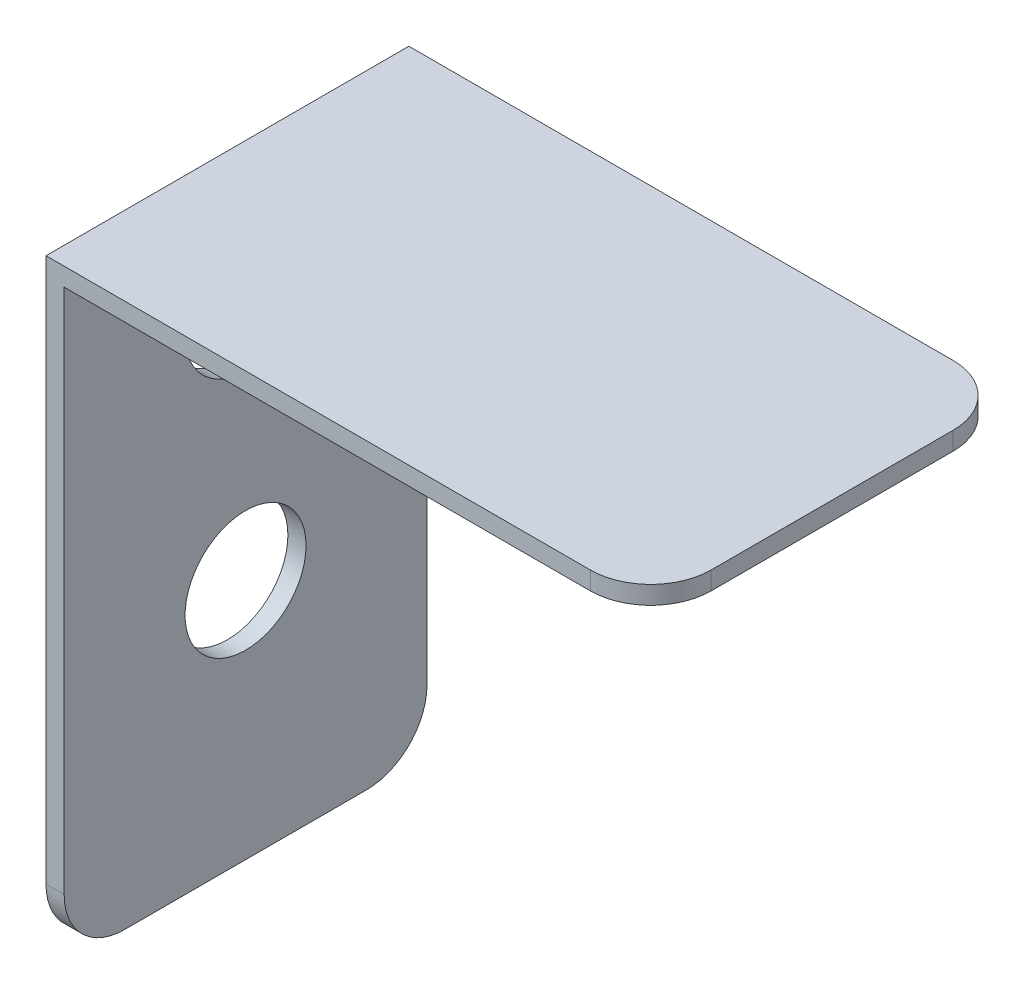
from build123d import *

# Parameters (mm, degrees)
BOSS_EXTRUDE1_DEPTH = 60
FILLET1_R           = 10
FILLET2_R           = 10
SKETCH2_R           = 10
CUT_EXTRUDE1_DEPTH  = 60


with BuildPart() as part:
    # Sketch1 → Boss-Extrude1 (new body)
    with BuildSketch(Plane.XY):
        Polygon((0, 0), (0, 100), (100, 100), (100, 97), (3, 97), (3, 0), align=None)
    extrude(amount=BOSS_EXTRUDE1_DEPTH)

    # Fillet1
    fillet1_edges = [part.edges().sort_by_distance(p)[0] for p in [
        (100, 98.5, 60),
        (100, 98.5, 0),
    ]]
    fillet(fillet1_edges, radius=FILLET1_R)

    # Fillet2
    fillet2_edges = [part.edges().sort_by_distance(p)[0] for p in [
        (1.5, 0, 60),
        (1.5, 0, 0),
    ]]
    fillet(fillet2_edges, radius=FILLET2_R)

    # Sketch2 → Cut-Extrude1 (cut)
    with BuildSketch(Plane(origin=(3, 0, 0), x_dir=(0, 0, -1), z_dir=(1, 0, 0))):
        with Locations((-30, 40)):
            Circle(SKETCH2_R)
        with Locations((-30, 80)):
            Circle(SKETCH2_R)
    extrude(amount=-CUT_EXTRUDE1_DEPTH, mode=Mode.SUBTRACT)


solid = part.part
